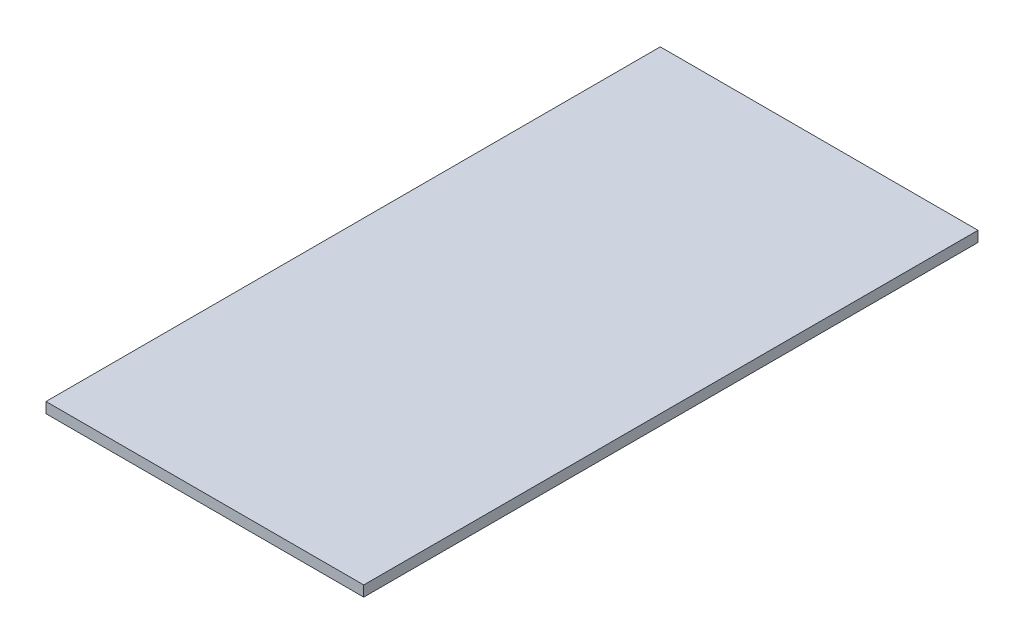
from build123d import *

# Parameters (mm, degrees)
SKETCH1_W           = 30
SKETCH1_H           = 58
BOSS_EXTRUDE1_DEPTH = 1


with BuildPart() as part:
    # Sketch1 → Boss-Extrude1 (new body)
    with BuildSketch(Plane(origin=(0, 0, 0), x_dir=(1, 0, 0), z_dir=(0, 1, 0))):
        with Locations((15, 29)):
            Rectangle(SKETCH1_W, SKETCH1_H)
    extrude(amount=BOSS_EXTRUDE1_DEPTH)


solid = part.part
